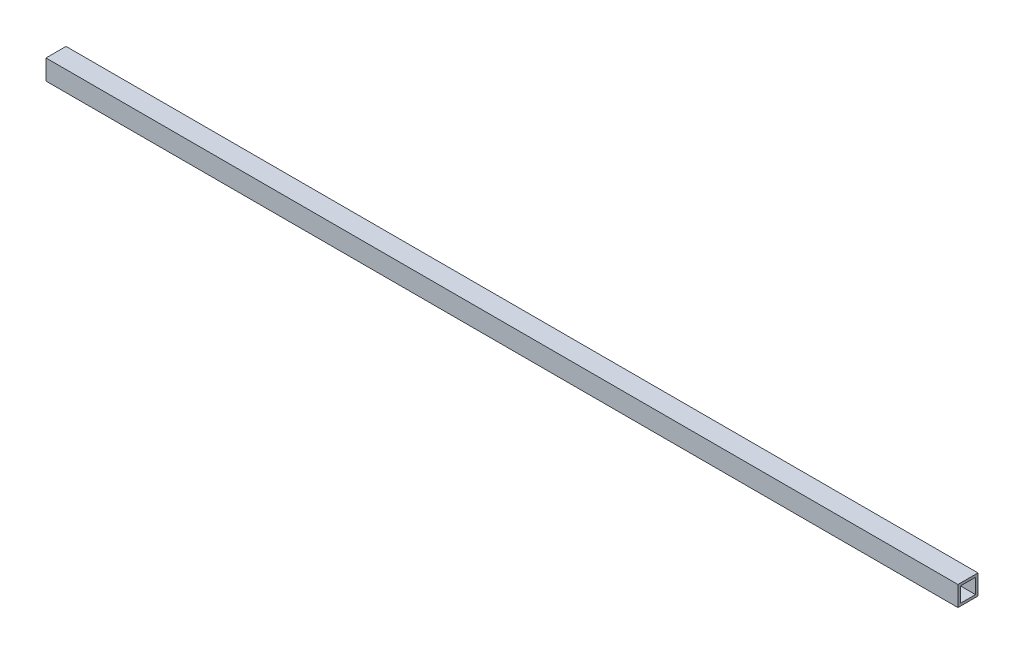
from build123d import *

# Parameters (mm, degrees)
SCHIZZO1_W                   = 40
SCHIZZO1_H                   = 40
SCHIZZO1_W_2                 = 30
SCHIZZO1_H_2                 = 30
ESTRUSIONE_ESTRUSIONE1_DEPTH = 910


with BuildPart() as part:
    # Schizzo1 → Estrusione-Estrusione1 (new, symmetric)
    with BuildSketch(Plane(origin=(0, 0, 0), x_dir=(0, -1, 0), z_dir=(1, 0, 0))):
        Rectangle(SCHIZZO1_W, SCHIZZO1_H)
        Rectangle(SCHIZZO1_W_2, SCHIZZO1_H_2, mode=Mode.SUBTRACT)
    extrude(amount=ESTRUSIONE_ESTRUSIONE1_DEPTH, both=True)


solid = part.part
